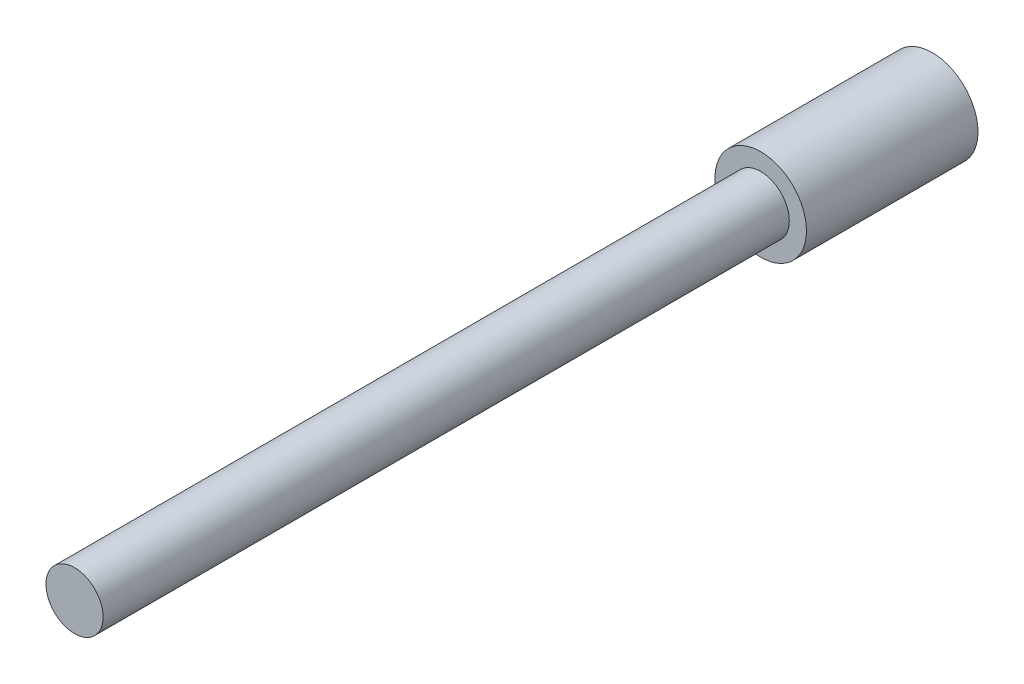
from build123d import *

# Parameters (mm, degrees)
SKETCH1_R           = 4
SKETCH1_R_2         = 1.5
BOSS_EXTRUDE1_DEPTH = 15
BOSS_EXTRUDE2_START = -5
SKETCH2_R           = 1.5
BOSS_EXTRUDE2_DEPTH = 5
SKETCH3_R           = 2.5
BOSS_EXTRUDE3_DEPTH = 60


with BuildPart() as part:
    # Sketch1 → Boss-Extrude1 (new body)
    with BuildSketch(Plane.XY):
        Circle(SKETCH1_R)
        Circle(SKETCH1_R_2, mode=Mode.SUBTRACT)
    extrude(amount=BOSS_EXTRUDE1_DEPTH)

    # Sketch2 → Boss-Extrude2 (add)
    with BuildSketch(Plane.XY.offset(15).offset(BOSS_EXTRUDE2_START)):
        Circle(SKETCH2_R)
    extrude(amount=BOSS_EXTRUDE2_DEPTH)

    # Sketch3 → Boss-Extrude3 (add)
    with BuildSketch(Plane.XY.offset(15)):
        Circle(SKETCH3_R)
    extrude(amount=BOSS_EXTRUDE3_DEPTH)


solid = part.part
